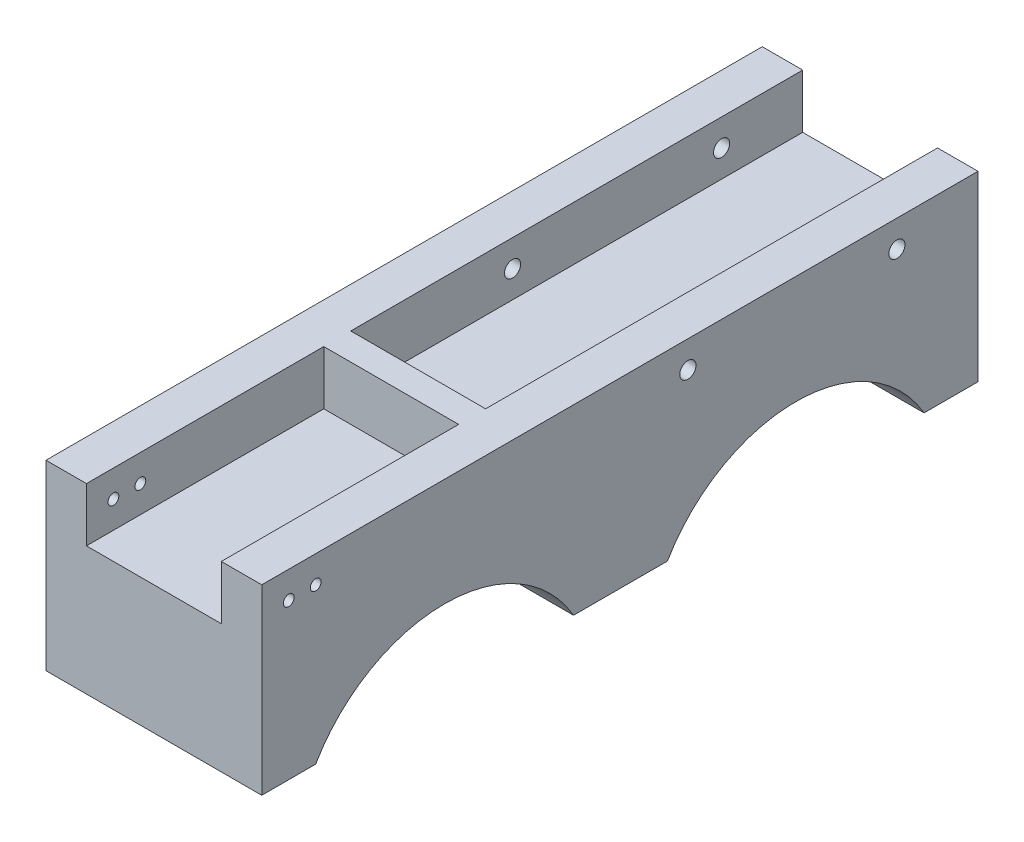
from build123d import *

# Parameters (mm, degrees)
SKETCH_2_R               = 2
SKETCH_2_R_2             = 3
EXTRUDE_1_DEPTH          = 80
CUT_EXTRUDE_2_REACH      = 221.122
CUT_EXTRUDE_2_END_RADIUS = 55.2
SKETCH_6_W               = 15
SKETCH_6_H               = 20
SKETCH_7_W               = 50
SKETCH_7_H               = 20
CUT_EXTRUDE_3_DEPTH      = 265.578124336
CUT_EXTRUDE_4_REACH      = 221.122
CUT_EXTRUDE_4_END_RADIUS = 55
SKETCH_8_W               = 15
SKETCH_8_H               = 20
SKETCH_9_W               = 50
SKETCH_9_H               = 10
EXTRUDE_2_DEPTH          = 20


with BuildPart() as part:
    # Эскиз2 → Бобышка-Вытянуть1 (new body)
    with BuildSketch(Plane(origin=(0, 0, 0), x_dir=(0, 0, -1), z_dir=(1, 0, 0))):
        with BuildLine():
            Line((-47.804602289, 27.6), (-67.804602289, 27.6))
            Line((-67.804602289, 27.6), (-67.804602289, 95.2))
            Line((-67.804602289, 95.2), (197.773522047, 95.2))
            Line((197.773522047, 95.2), (197.773522047, 27.6))
            Line((197.773522047, 27.6), (177.773522047, 27.6))
            ThreePointArc((177.773522047, 27.6), (161.886250902, 44.955327869), (140.2, 54.083269132))
            Line((140.2, 54.083269132), (140.2, 45.2))
            Line((140.2, 45.2), (120.2, 45.2))
            Line((120.2, 45.2), (120.2, 54.083269132))
            ThreePointArc((120.2, 54.083269132), (98.513749098, 44.955327869), (82.626477953, 27.6))
            Line((82.626477953, 27.6), (47.804602289, 27.6))
            ThreePointArc((47.804602289, 27.6), (31.83374449, 45.096038759), (10, 54.286646609))
            Line((10, 54.286646609), (10, 45.2))
            Line((10, 45.2), (-10, 45.2))
            Line((-10, 45.2), (-10, 54.286646609))
            ThreePointArc((-10, 54.286646609), (-31.83374449, 45.096038759), (-47.804602289, 27.6))
        make_face()
        with Locations((-47.804602289, 85.2)):
            Circle(SKETCH_2_R, mode=Mode.SUBTRACT)
        with Locations((-57.804602289, 85.2)):
            Circle(SKETCH_2_R, mode=Mode.SUBTRACT)
        with Locations((90.2, 85.2)):
            Circle(SKETCH_2_R_2, mode=Mode.SUBTRACT)
        with Locations((167.7, 85.2)):
            Circle(SKETCH_2_R_2, mode=Mode.SUBTRACT)
    extrude(amount=EXTRUDE_1_DEPTH)

    # Вырез-Вытянуть2: up to this cylinder (the profile starts inside it)
    cut_extrude_2_end = Plane(origin=(40, 0, 0), z_dir=(-1, 0, 0)) * Cylinder(CUT_EXTRUDE_2_END_RADIUS, 618.644, mode=Mode.PRIVATE)
    # Эскиз6 → Вырез-Вытянуть2 (cut, up to the surface)
    with BuildSketch(Plane.XZ.offset(-45.2), mode=Mode.PRIVATE) as cut_extrude_2_sk1:
        with Locations((7.5, 0)):
            Rectangle(SKETCH_6_W, SKETCH_6_H)
    cut_extrude_2_tool1 = extrude(cut_extrude_2_sk1.sketch, amount=-CUT_EXTRUDE_2_REACH, mode=Mode.PRIVATE) & cut_extrude_2_end
    add(cut_extrude_2_tool1.solids().sort_by_distance((7.5, 45.2, 0))[0], mode=Mode.SUBTRACT)
    # Эскиз6 → Вырез-Вытянуть2 (cut, up to the surface)
    with BuildSketch(Plane.XZ.offset(-45.2), mode=Mode.PRIVATE) as cut_extrude_2_sk2:
        with Locations((72.5, 0)):
            Rectangle(SKETCH_6_W, SKETCH_6_H)
    cut_extrude_2_tool2 = extrude(cut_extrude_2_sk2.sketch, amount=-CUT_EXTRUDE_2_REACH, mode=Mode.PRIVATE) & cut_extrude_2_end
    add(cut_extrude_2_tool2.solids().sort_by_distance((72.5, 45.2, 0))[0], mode=Mode.SUBTRACT)

    # Эскиз7 → Вырез-Вытянуть3 (cut)
    with BuildSketch(Plane(origin=(0, 0, -197.773522047), x_dir=(-1, 0, 0), z_dir=(0, 0, -1))):
        with Locations((-40, 85.2)):
            Rectangle(SKETCH_7_W, SKETCH_7_H)
    extrude(amount=-CUT_EXTRUDE_3_DEPTH, mode=Mode.SUBTRACT)

    # Вырез-Вытянуть4: up to this cylinder (the profile starts inside it)
    cut_extrude_4_end = Plane(origin=(40, 0, -130.2), z_dir=(-1, 0, 0)) * Cylinder(CUT_EXTRUDE_4_END_RADIUS, 618.244, mode=Mode.PRIVATE)
    # Эскиз8 → Вырез-Вытянуть4 (cut, up to the surface)
    with BuildSketch(Plane.XZ.offset(-45.2), mode=Mode.PRIVATE) as cut_extrude_4_sk1:
        with Locations((7.5, -130.2)):
            Rectangle(SKETCH_8_W, SKETCH_8_H)
    cut_extrude_4_tool1 = extrude(cut_extrude_4_sk1.sketch, amount=-CUT_EXTRUDE_4_REACH, mode=Mode.PRIVATE) & cut_extrude_4_end
    add(cut_extrude_4_tool1.solids().sort_by_distance((7.5, 45.2, -130.2))[0], mode=Mode.SUBTRACT)
    # Эскиз8 → Вырез-Вытянуть4 (cut, up to the surface)
    with BuildSketch(Plane.XZ.offset(-45.2), mode=Mode.PRIVATE) as cut_extrude_4_sk2:
        with Locations((72.5, -130.2)):
            Rectangle(SKETCH_8_W, SKETCH_8_H)
    cut_extrude_4_tool2 = extrude(cut_extrude_4_sk2.sketch, amount=-CUT_EXTRUDE_4_REACH, mode=Mode.PRIVATE) & cut_extrude_4_end
    add(cut_extrude_4_tool2.solids().sort_by_distance((72.5, 45.2, -130.2))[0], mode=Mode.SUBTRACT)

    # Эскиз9 → Бобышка-Вытянуть2 (add)
    with BuildSketch(Plane(origin=(0, 75.2, 0), x_dir=(1, 0, 0), z_dir=(0, 1, 0))):
        with Locations((40, 25.2)):
            Rectangle(SKETCH_9_W, SKETCH_9_H)
    extrude(amount=EXTRUDE_2_DEPTH)


solid = part.part
